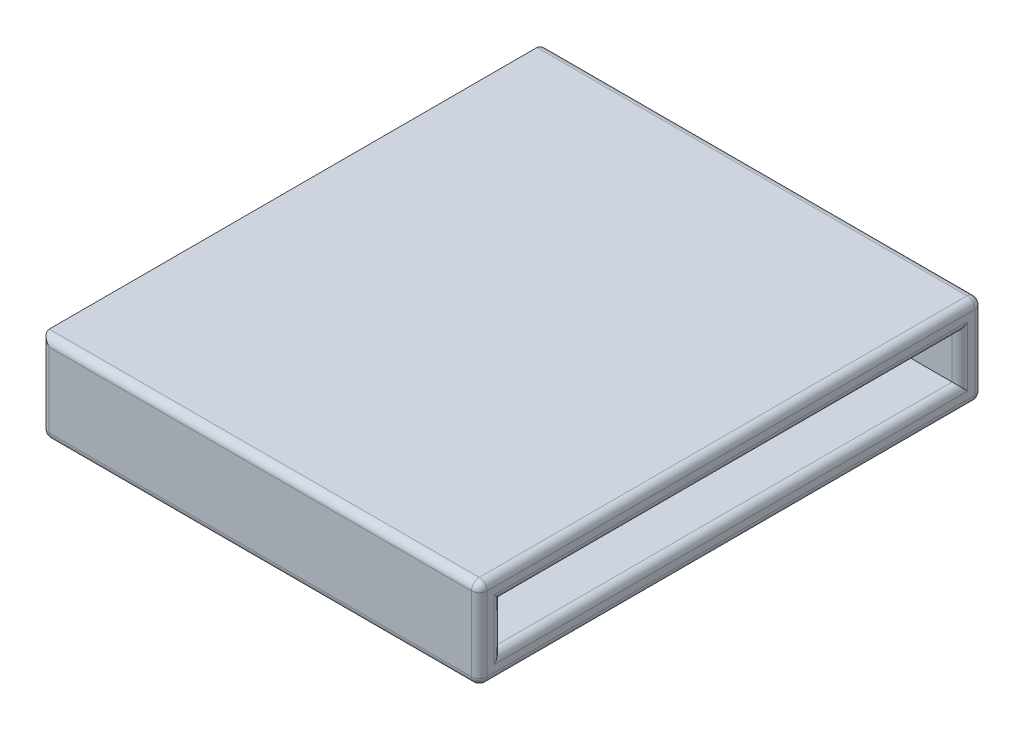
from build123d import *

# Parameters (mm, degrees)
SKETCH1_W           = 56
SKETCH1_H           = 64.37
SKETCH1_W_2         = 50
SKETCH1_H_2         = 58.37
BOSS_EXTRUDE1_DEPTH = 11.5
SKETCH2_W           = 58.57
SKETCH2_H           = 5.7
CUT_EXTRUDE1_DEPTH  = 103
FILLET1_R           = 1


with BuildPart() as part:
    # Sketch1 → Boss-Extrude1 (new body)
    # profile 1 of 2: a face of its own
    with BuildSketch(Plane(origin=(0, 0, 0), x_dir=(1, 0, 0), z_dir=(0, 1, 0))):
        Rectangle(SKETCH1_W, SKETCH1_H)
        Rectangle(SKETCH1_W_2, SKETCH1_H_2, mode=Mode.SUBTRACT)
    # profile 2 of 2: a face of its own
    with BuildSketch(Plane(origin=(0, 0, 0), x_dir=(1, 0, 0), z_dir=(0, 1, 0))):
        Rectangle(SKETCH1_W_2, SKETCH1_H_2)
    extrude(amount=BOSS_EXTRUDE1_DEPTH)

    # Sketch2 → Cut-Extrude1 (cut)
    with BuildSketch(Plane.ZY.offset(28)):
        with Locations((0, 5.75)):
            Rectangle(SKETCH2_W, SKETCH2_H)
    extrude(amount=-CUT_EXTRUDE1_DEPTH, mode=Mode.SUBTRACT)

    # Fillet1
    fillet1_edges = [part.edges().sort_by_distance(p)[0] for p in [
        (0, 11.5, 32.185),
        (28, 11.5, 0),
        (0, 11.5, -32.185),
        (28, 2.9, 0),
        (-28, 5.75, -29.285),
        (-28, 8.6, 0),
        (28, 5.75, 29.285),
        (28, 5.75, -29.285),
        (28, 8.6, 0),
        (-28, 2.9, 0),
        (-28, 5.75, 29.285),
        (0, 0, -32.185),
        (28, 0, 0),
        (0, 0, 32.185),
        (-28, 0, 0),
        (-28, 5.75, -32.185),
        (28, 5.75, -32.185),
        (28, 5.75, 32.185),
        (-28, 5.75, 32.185),
    ]]
    fillet(fillet1_edges, radius=FILLET1_R)


solid = part.part
